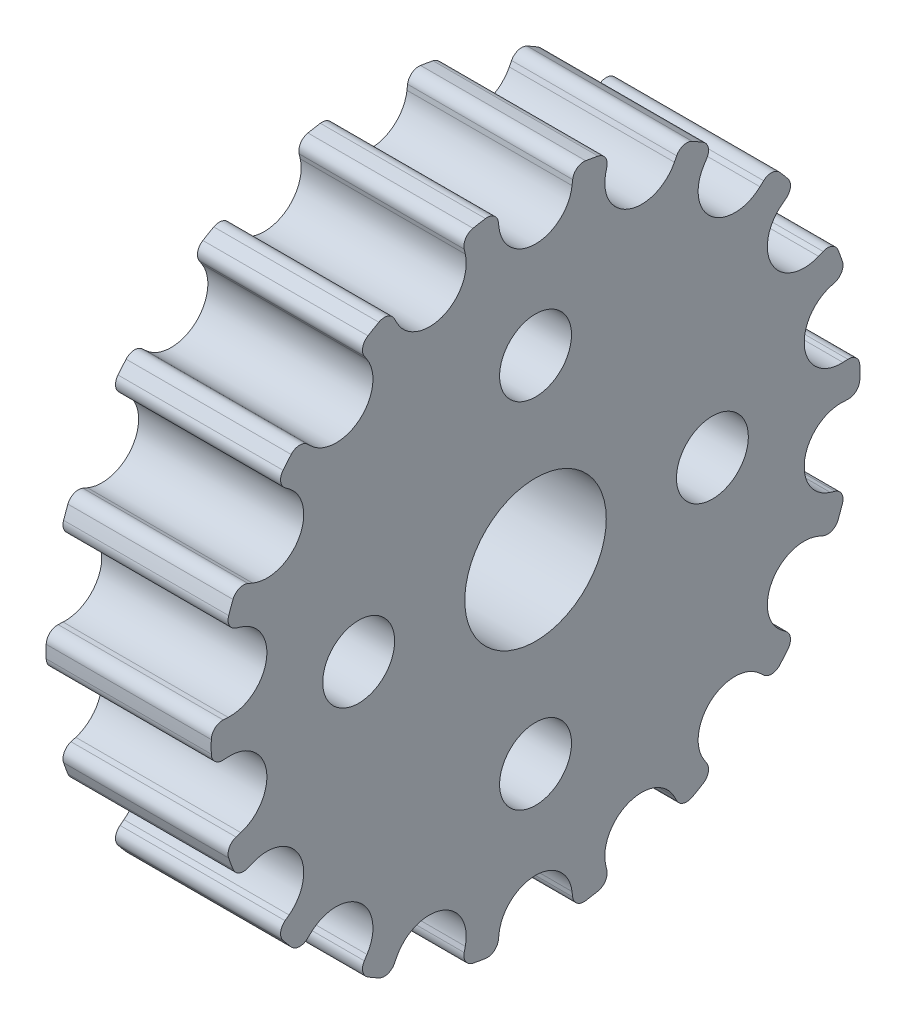
from build123d import *

# Parameters (mm, degrees)
CHAMFER_1_SIZE           = 1
SKETCH_4_W               = 2
SKETCH_4_H               = 1
CUT_EXTRUDE_1_DEPTH      = 35.092374778
CUT_EXTRUDE_2_REACH      = 36.092
PATTERN_CIRCULAR_3_COUNT = 18
SKETCH_7_R               = 25
CUT_EXTRUDE_3_DEPTH      = 21
SKETCH_8_R               = 5
EXTRUDE_1_DEPTH          = 7
SKETCH_10_R              = 3
CUT_EXTRUDE_4_DEPTH      = 10
SKETCH_11_R              = 1.525
CUT_EXTRUDE_5_DEPTH      = 46


with BuildPart() as part:
    # 草图1 → 旋转1 (revolve)
    with BuildSketch(Plane.XY, mode=Mode.PRIVATE) as revolve_1_sk:
        Polygon((0, 2.7506), (0, 13.753), (28, 13.753), (28, 5.5012), (20, 5.5012), (20, 2.7506), align=None)
    revolve(revolve_1_sk.sketch.rotate(Axis((0, 0, 0), (1, 0, 0)), 90), axis=Axis((0, 0, 0), (1, 0, 0)))

    # 倒角1
    chamfer_1_edges = [part.edges().sort_by_distance(p)[0] for p in [
        (20, 0, -2.7506),
        (0, 0, -2.7506),
    ]]
    chamfer(chamfer_1_edges, length=CHAMFER_1_SIZE)

    # 草图4 → 切除-拉伸1 (cut, through all)
    with BuildSketch(Plane.ZY):
        with Locations((0, 3.062381775)):
            Rectangle(SKETCH_4_W, SKETCH_4_H)
    extrude(amount=-CUT_EXTRUDE_1_DEPTH, mode=Mode.SUBTRACT)

    # 草图6 → 切除-拉伸2 (cut, up to next)
    with BuildSketch(Plane(origin=(0, 0, 0), x_dir=(0, 0, -1), z_dir=(1, 0, 0)), mode=Mode.PRIVATE) as cut_extrude_2_sk1:
        with BuildLine():
            Line((1.574067282, 13.17215513), (1.548371997, 12.962883824))
            ThreePointArc((1.548371997, 12.962883824), (0, 11.593), (-1.548371997, 12.962883824))
            Line((-1.548371997, 12.962883824), (-1.574067282, 13.17215513))
            ThreePointArc((-1.574067282, 13.17215513), (-1.761240253, 13.496717776), (-2.124642597, 13.587895453))
            ThreePointArc((-2.124642597, 13.587895453), (-2.36143787, 13.548749765), (-2.597513963, 13.505477785))
            Line((-2.597513963, 13.505477785), (-2.794161951, 15.107047128))
            ThreePointArc((-2.794161951, 15.107047128), (0, 15.363274844), (2.794161951, 15.107047128))
            Line((2.794161951, 15.107047128), (2.597513963, 13.505477785))
            ThreePointArc((2.597513963, 13.505477785), (2.36143787, 13.548749765), (2.124642597, 13.587895453))
            ThreePointArc((2.124642597, 13.587895453), (1.761240253, 13.496717776), (1.574067282, 13.17215513))
        make_face()
    cut_extrude_2_tool1 = extrude(cut_extrude_2_sk1.sketch, amount=CUT_EXTRUDE_2_REACH, mode=Mode.PRIVATE) & part.part
    cut_extrude_2 = cut_extrude_2_tool1.solids().sort_by_distance((0, 13.819423, 0))[0]
    add(cut_extrude_2, mode=Mode.SUBTRACT)

    # 阵列(圆周)3: 切除-拉伸2 ×18 about axis
    pattern_circular_3_axis = Axis((0, 0, 0), (1, 0, 0))
    for i in range(1, PATTERN_CIRCULAR_3_COUNT):
        add(cut_extrude_2.rotate(pattern_circular_3_axis, i * 360 / PATTERN_CIRCULAR_3_COUNT), mode=Mode.SUBTRACT)

    # 草图7 → 切除-拉伸3 (cut)
    with BuildSketch(Plane(origin=(28, 0, 0), x_dir=(0, 0, -1), z_dir=(1, 0, 0))):
        Circle(SKETCH_7_R)
    extrude(amount=-CUT_EXTRUDE_3_DEPTH, mode=Mode.SUBTRACT)

    # 草图8 → 凸台-拉伸1 (add)
    with BuildSketch(Plane(origin=(7, 0, 0), x_dir=(0, 0, -1), z_dir=(1, 0, 0))):
        Circle(SKETCH_8_R)
    extrude(amount=-EXTRUDE_1_DEPTH)

    # 草图10 → 切除-拉伸4 (cut)
    with BuildSketch(Plane(origin=(7, 0, 0), x_dir=(0, 0, -1), z_dir=(1, 0, 0))):
        Circle(SKETCH_10_R)
    extrude(amount=-CUT_EXTRUDE_4_DEPTH, mode=Mode.SUBTRACT)

    # 草图11 → 切除-拉伸5 (cut)
    with BuildSketch(Plane(origin=(7, 0, 0), x_dir=(0, 0, -1), z_dir=(1, 0, 0))):
        with Locations((0, 7.5)):
            Circle(SKETCH_11_R)
        with Locations((7.5, 0)):
            Circle(SKETCH_11_R)
        with Locations((0, -7.5)):
            Circle(SKETCH_11_R)
        with Locations((-7.5, 0)):
            Circle(SKETCH_11_R)
    extrude(amount=-CUT_EXTRUDE_5_DEPTH, mode=Mode.SUBTRACT)


solid = part.part
